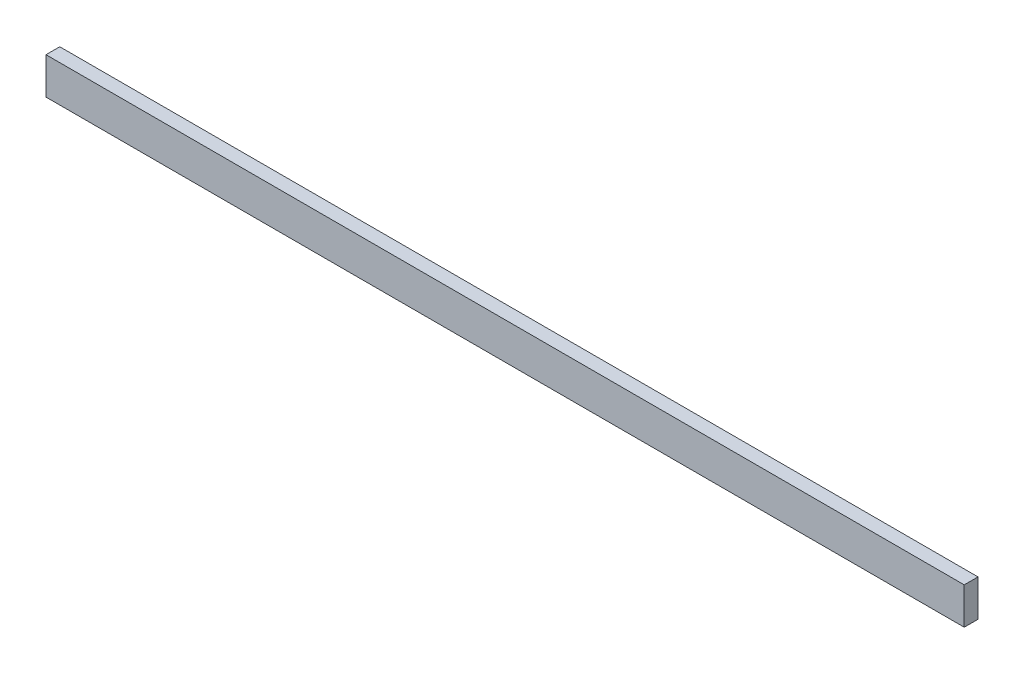
from build123d import *

# Parameters (mm, degrees)
SKETCH1_W           = 75
SKETCH1_H           = 200
BOSS_EXTRUDE1_DEPTH = 5000


with BuildPart() as part:
    # Sketch1 → Boss-Extrude1 (new body)
    with BuildSketch(Plane(origin=(0, 0, 0), x_dir=(0, 0, -1), z_dir=(1, 0, 0))):
        with Locations((37.5, 100)):
            Rectangle(SKETCH1_W, SKETCH1_H)
    extrude(amount=BOSS_EXTRUDE1_DEPTH)


solid = part.part
